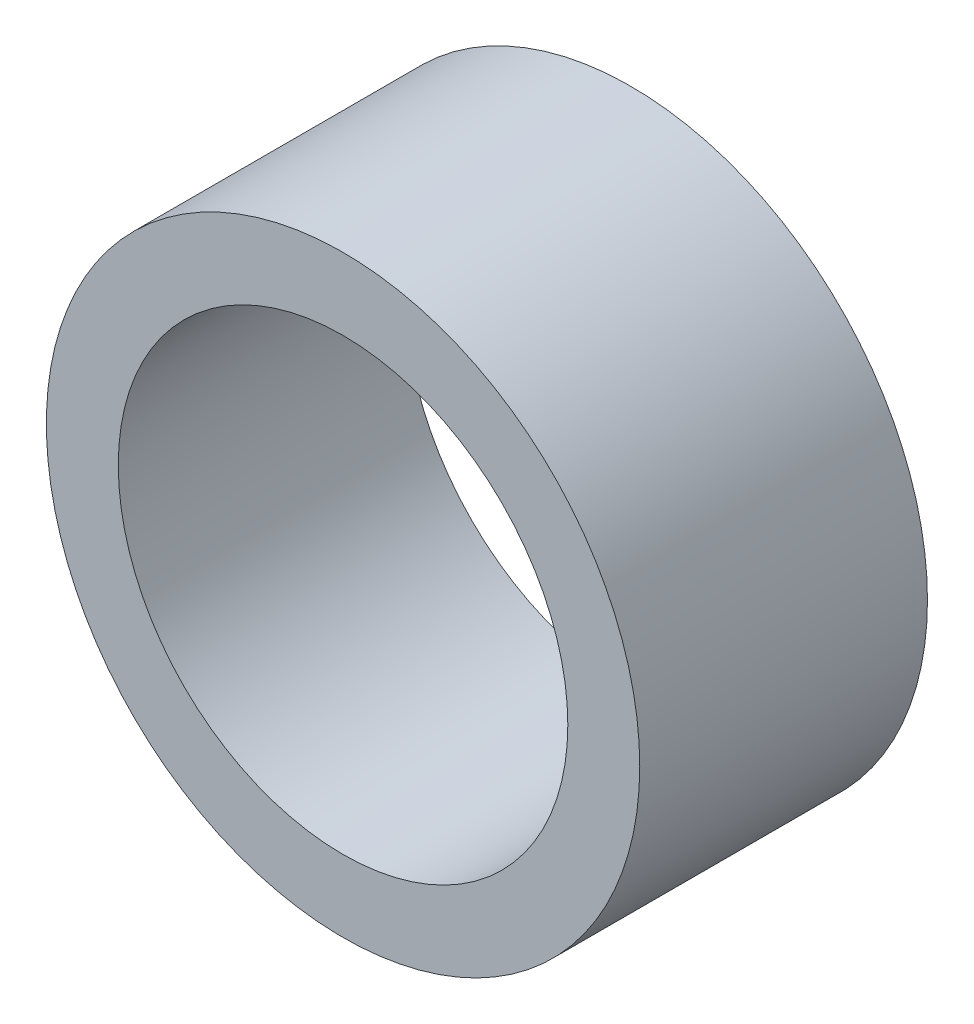
from build123d import *

# Parameters (mm, degrees)
SKETCH_1_R      = 16.5
SKETCH_1_R_2    = 12.5
EXTRUDE_1_DEPTH = 16


with BuildPart() as part:
    # 草图1 → 凸台-拉伸1 (new body)
    with BuildSketch(Plane.XY):
        Circle(SKETCH_1_R)
        Circle(SKETCH_1_R_2, mode=Mode.SUBTRACT)
    extrude(amount=EXTRUDE_1_DEPTH)


solid = part.part
